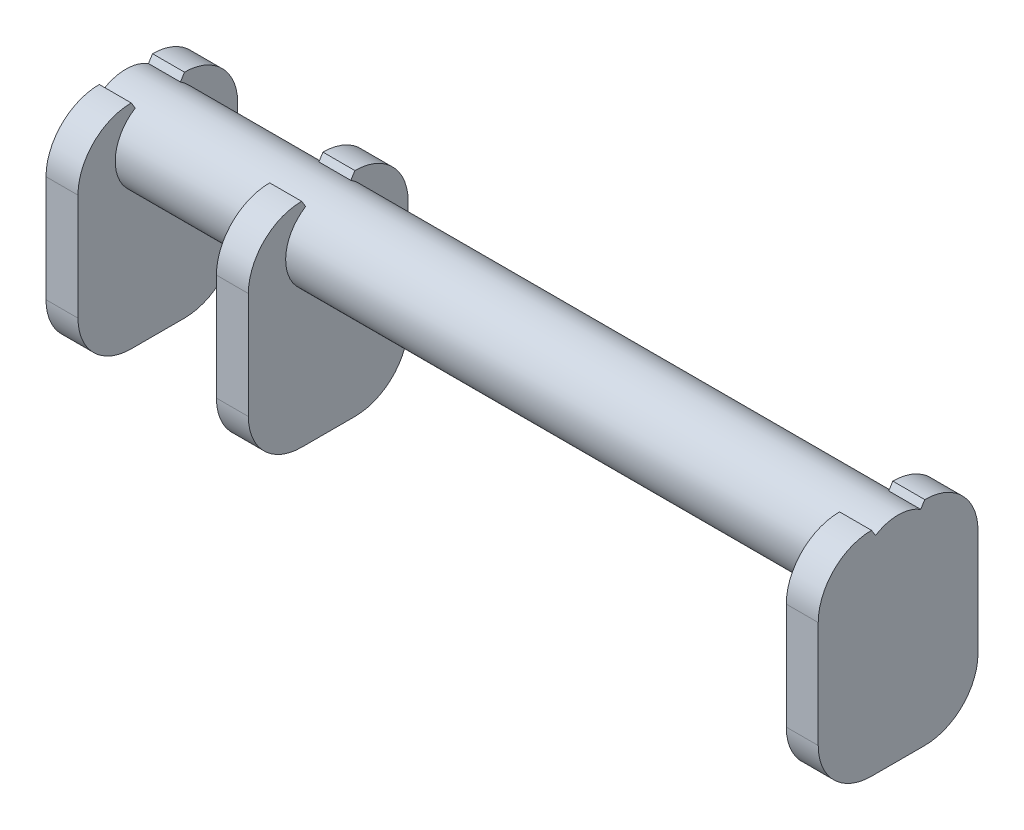
from build123d import *

# Parameters (mm, degrees)
SCHIZZO1_R                   = 8
ESTRUSIONE_ESTRUSIONE1_DEPTH = 145
ESTRUSIONE_ESTRUSIONE2_DEPTH = 6
RIPETIZIONE_A_L1_COUNT       = 2
RIPETIZIONE_A_L1_PITCH       = 32
RIPETIZIONE_A_L2_COUNT       = 2
RIPETIZIONE_A_L2_PITCH       = 139
EXTRUDE2_DEPTH               = 150.244765402


with BuildPart() as part:
    # Schizzo1 → Estrusione-Estrusione1 (new body)
    with BuildSketch(Plane(origin=(0, 0, 0), x_dir=(0, 0, -1), z_dir=(1, 0, 0))):
        Circle(SCHIZZO1_R)
    extrude(amount=ESTRUSIONE_ESTRUSIONE1_DEPTH)

    # Schizzo2 → Estrusione-Estrusione2 (add)
    with BuildSketch(Plane.ZY):
        with BuildLine():
            Line((-5, 8), (5, 8))
            ThreePointArc((5, 8), (12.071067812, 5.071067812), (15, -2))
            Line((15, -2), (15, -22))
            ThreePointArc((15, -22), (12.071067812, -29.071067812), (5, -32))
            Line((5, -32), (-5, -32))
            ThreePointArc((-5, -32), (-12.071067812, -29.071067812), (-15, -22))
            Line((-15, -22), (-15, -2))
            ThreePointArc((-15, -2), (-12.071067812, 5.071067812), (-5, 8))
        make_face()
    estrusione_estrusione2 = extrude(amount=-ESTRUSIONE_ESTRUSIONE2_DEPTH)

    # Ripetizione a L1: Estrusione-Estrusione2 ×2
    with Locations(*[(i * RIPETIZIONE_A_L1_PITCH, 0, 0) for i in range(1, RIPETIZIONE_A_L1_COUNT)]):
        add(estrusione_estrusione2)

    # Ripetizione a L2: Estrusione-Estrusione2 ×2
    with Locations(*[(i * RIPETIZIONE_A_L2_PITCH, 0, 0) for i in range(1, RIPETIZIONE_A_L2_COUNT)]):
        add(estrusione_estrusione2)

    # Sketch1 → Extrude2 (cut, through all)
    with BuildSketch(Plane.ZY):
        with BuildLine():
            Line((-5, 8), (-4.23999152, 6.783986432))
            ThreePointArc((-4.23999152, 6.783986432), (0, 8), (4.23999152, 6.783986432))
            Line((4.23999152, 6.783986432), (5, 8))
            Line((5, 8), (5, 8.502646834))
            Line((5, 8.502646834), (-5, 8.502646834))
            Line((-5, 8.502646834), (-5, 8))
        make_face()
    extrude(amount=-EXTRUDE2_DEPTH, mode=Mode.SUBTRACT)


solid = part.part
